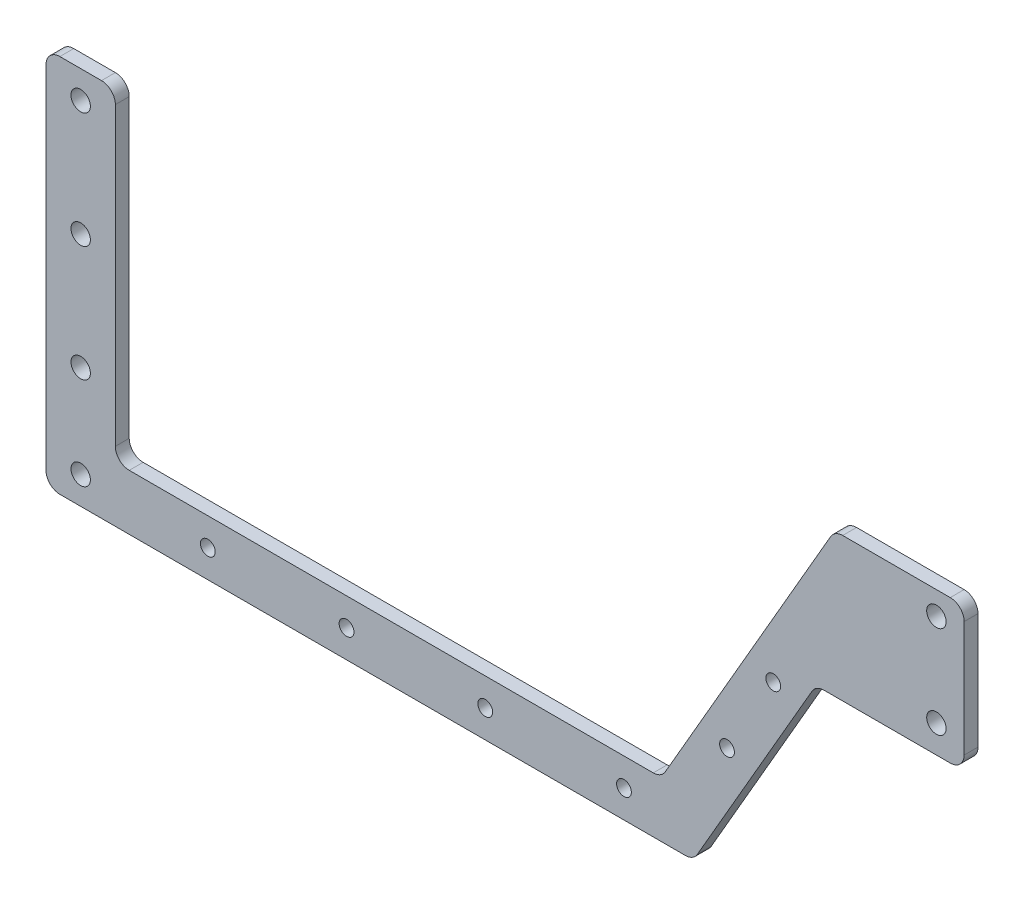
from build123d import *

# Parameters (mm, degrees)
SKETCH_1_R          = 2.1
EXTRUDE_1_DEPTH     = 3
FILLET_2_R          = 3
SKETCH_3_R          = 1.6
SKETCH_3_R_2        = 2.1
CUT_EXTRUDE_2_DEPTH = 3


with BuildPart() as part:
    # 草图1 → 凸台-拉伸1 (new body)
    with BuildSketch(Plane.XY):
        Polygon((0, 0), (0, 31), (-28, 31), (-65.5, -33.951905284), (-183.57179677, -33.951905284), (-183.57179677, 36.048094716), (-198.57179677, 36.048094716), (-198.57179677, -45.951905284), (-58.57179677, -45.951905284), (-32.041451884, 0), align=None)
        with Locations((-6, 26)):
            Circle(SKETCH_1_R, mode=Mode.SUBTRACT)
        with Locations((-6, 6)):
            Circle(SKETCH_1_R, mode=Mode.SUBTRACT)
    extrude(amount=EXTRUDE_1_DEPTH)

    # 圆角2
    fillet_2_edges = [part.edges().sort_by_distance(p)[0] for p in [
        (-32.041451884, 0, 1.5),
        (-58.57179677, -45.951905284, 1.5),
        (-198.57179677, -45.951905284, 1.5),
        (-198.57179677, 36.048094716, 1.5),
        (-183.57179677, 36.048094716, 1.5),
        (-183.57179677, -33.951905284, 1.5),
        (-65.5, -33.951905284, 1.5),
        (-28, 31, 1.5),
        (0, 31, 1.5),
        (0, 0, 1.5),
    ]]
    fillet(fillet_2_edges, radius=FILLET_2_R)

    # 草图3 → 切除-拉伸2 (cut)
    with BuildSketch(Plane.XY.offset(3)):
        with Locations((-41.279056191, -4)):
            Circle(SKETCH_3_R)
        with Locations((-51.279056191, -21.320508076)):
            Circle(SKETCH_3_R)
        with Locations((-73.57179677, -39.951905284)):
            Circle(SKETCH_3_R)
        with Locations((-103.57179677, -39.951905284)):
            Circle(SKETCH_3_R)
        with Locations((-133.57179677, -39.951905284)):
            Circle(SKETCH_3_R)
        with Locations((-191.07179677, -19.951905284)):
            Circle(SKETCH_3_R_2)
        with Locations((-191.07179677, 5.048094716)):
            Circle(SKETCH_3_R_2)
        with Locations((-191.07179677, 30.048094716)):
            Circle(SKETCH_3_R_2)
        with Locations((-191.07179677, -39.951905284)):
            Circle(SKETCH_3_R_2)
        with Locations((-163.57179677, -39.951905284)):
            Circle(SKETCH_3_R)
    extrude(amount=-CUT_EXTRUDE_2_DEPTH, mode=Mode.SUBTRACT)


solid = part.part
